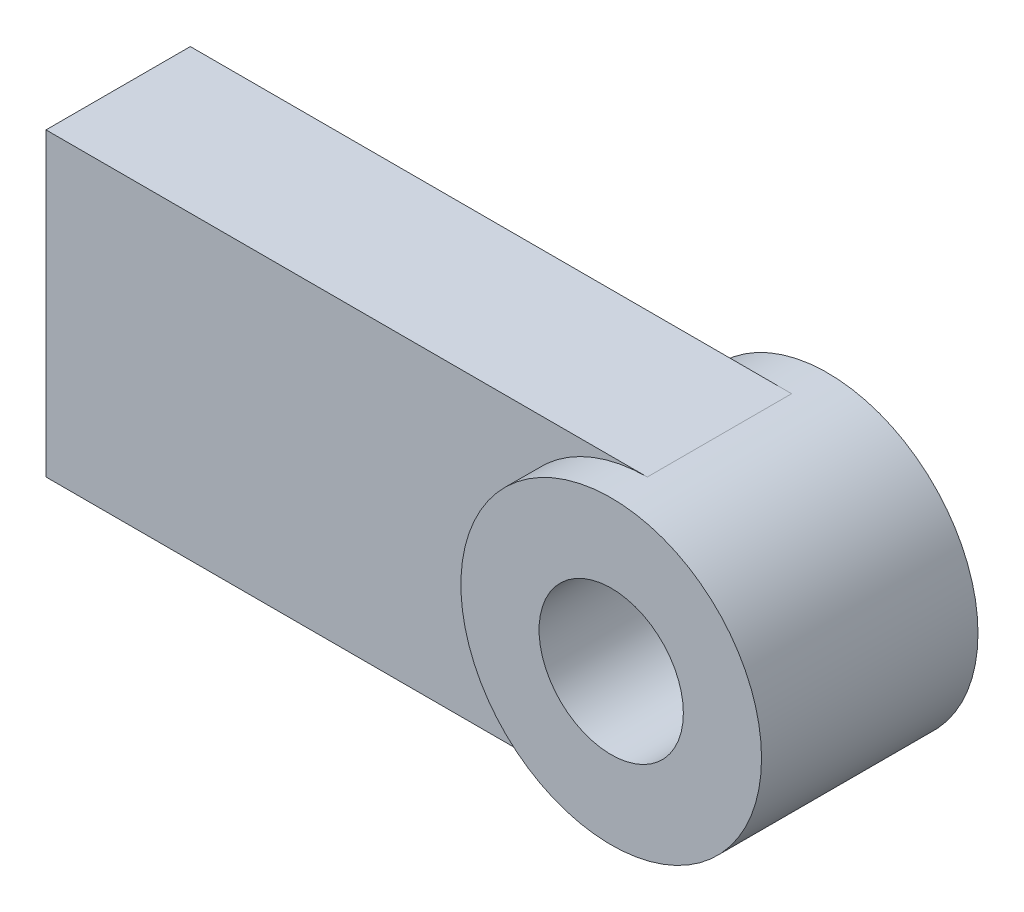
from build123d import *

# Parameters (mm, degrees)
SKETCH1_W           = 50000
SKETCH1_H           = 25000
BOSS_EXTRUDE1_DEPTH = 12000
SKETCH2_R           = 12500
BOSS_EXTRUDE2_DEPTH = 15000
BOSS_EXTRUDE3_START = 3000
SKETCH3_R           = 12500
BOSS_EXTRUDE3_DEPTH = 3000
SKETCH4_R           = 6000
CUT_EXTRUDE1_DEPTH  = 18000


with BuildPart() as part:
    # Sketch1 → Boss-Extrude1 (new body)
    with BuildSketch(Plane.XY):
        with Locations((25000, 12500)):
            Rectangle(SKETCH1_W, SKETCH1_H)
    extrude(amount=-BOSS_EXTRUDE1_DEPTH)

    # Sketch2 → Boss-Extrude2 (add)
    with BuildSketch(Plane.XY):
        with Locations((50000, 12500)):
            Circle(SKETCH2_R)
    extrude(amount=-BOSS_EXTRUDE2_DEPTH)

    # Sketch3 → Boss-Extrude3 (add)
    with BuildSketch(Plane.XY.offset(BOSS_EXTRUDE3_START)):
        with Locations((50000, 12500)):
            Circle(SKETCH3_R)
    extrude(amount=-BOSS_EXTRUDE3_DEPTH)

    # Sketch4 → Cut-Extrude1 (cut)
    with BuildSketch(Plane.XY.offset(3000)):
        with Locations((50000, 12500)):
            Circle(SKETCH4_R)
    extrude(amount=-CUT_EXTRUDE1_DEPTH, mode=Mode.SUBTRACT)


solid = part.part
